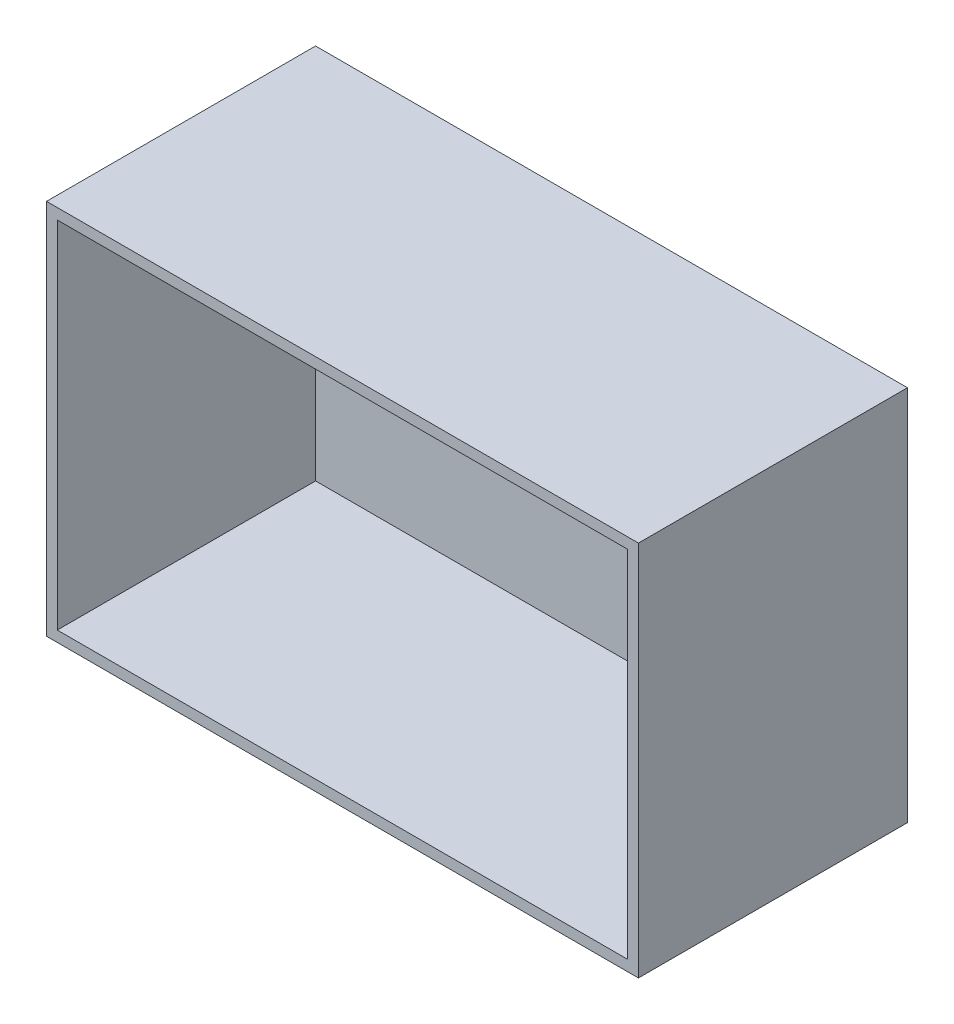
from build123d import *

# Parameters (mm, degrees)
SKETCH1_W           = 139.7
SKETCH1_H           = 88.9
BOSS_EXTRUDE1_DEPTH = 63.5
SHELL1_T            = -2.54
SKETCH2_R           = 7.62
CUT_EXTRUDE1_DEPTH  = 76.2


with BuildPart() as part:
    # Sketch1 → Boss-Extrude1 (new body)
    with BuildSketch(Plane.XY):
        with Locations((11.561325185, -19.571420525)):
            Rectangle(SKETCH1_W, SKETCH1_H)
    extrude(amount=BOSS_EXTRUDE1_DEPTH)

    # Shell1
    shell1_openings = [part.faces().sort_by_distance(p)[0] for p in [
        (11.561325185, -19.571420525, 63.5),
    ]]
    offset(amount=SHELL1_T, openings=shell1_openings, kind=Kind.INTERSECTION)

    # Sketch2 → Cut-Extrude1 (cut)
    with BuildSketch(Plane(origin=(0, 0, 0), x_dir=(-1, 0, 0), z_dir=(0, 0, -1))):
        with Locations((-40.771325185, -20.31733829)):
            Circle(SKETCH2_R)
    extrude(amount=-CUT_EXTRUDE1_DEPTH, mode=Mode.SUBTRACT)


solid = part.part
